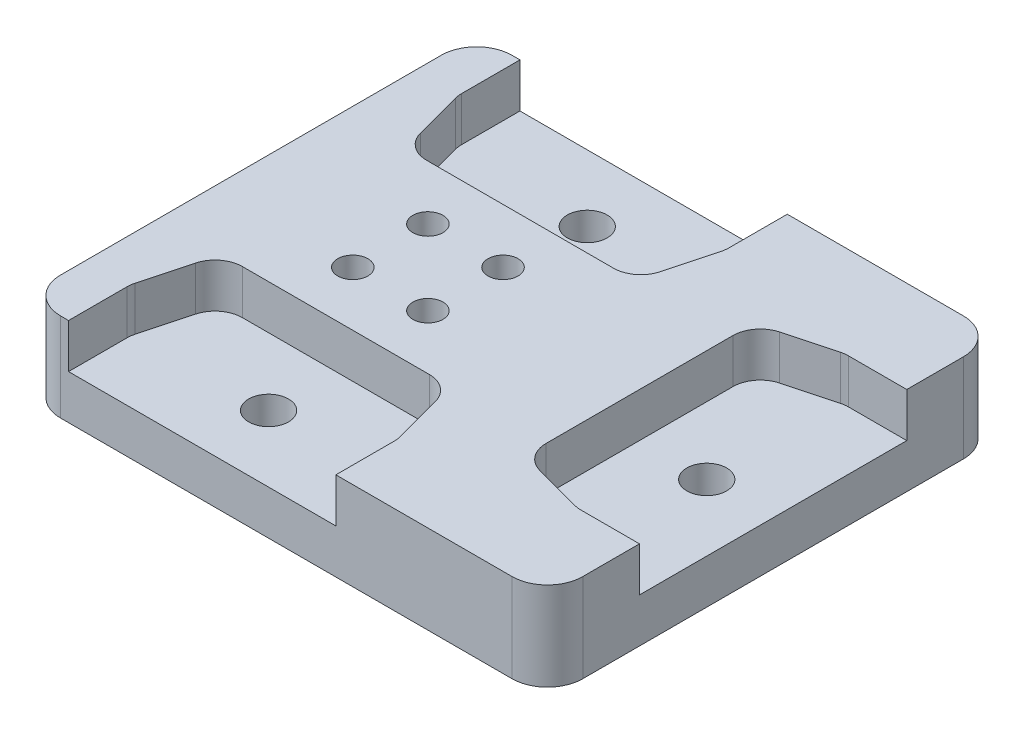
from build123d import *

# Parameters (mm, degrees)
SKETCH_1_W          = 59
SKETCH_1_H          = 51
EXTRUDE_1_DEPTH     = 10
CUT_EXTRUDE_1_DEPTH = 5
CUT_EXTRUDE_2_DEPTH = 5
HOLE_WIZARD_M31_D   = 3.4
FILLET_1_R          = 4
FILLET_2_R          = 4
HOLE_WIZARD_M41_D   = 4.5
CUT_EXTRUDE_4_DEPTH = 5


with BuildPart() as part:
    # Эскиз1 → Бобышка-Вытянуть1 (new body)
    with BuildSketch(Plane(origin=(0, 0, 0), x_dir=(1, 0, 0), z_dir=(0, 1, 0))):
        with Locations((29.5, 25.5)):
            Rectangle(SKETCH_1_W, SKETCH_1_H)
    extrude(amount=EXTRUDE_1_DEPTH)

    # Эскиз3 → Вырез-Вытянуть1 (cut)
    with BuildSketch(Plane(origin=(28.521351565, 10, -17.681729678), x_dir=(1, 0, 0), z_dir=(0, 1, 0))):
        with BuildLine():
            Line((-23.621351565, -11.07668717), (-23.621351565, -17.781729678))
            Line((-23.621351565, -17.781729678), (6.578648435, -17.781729678))
            Line((6.578648435, -17.781729678), (6.578648435, -11.07668717))
            ThreePointArc((6.578648435, -11.07668717), (6.552127505, -10.672055974), (6.473018496, -10.27434813))
            Line((6.473018496, -10.27434813), (5.027443993, -4.879390638))
            ThreePointArc((5.027443993, -4.879390638), (3.920234361, -3.222334323), (2.033073931, -2.581729678))
            Line((2.033073931, -2.581729678), (-19.075777062, -2.581729678))
            ThreePointArc((-19.075777062, -2.581729678), (-20.962937492, -3.222334323), (-22.070147123, -4.879390638))
            Line((-22.070147123, -4.879390638), (-23.515721627, -10.27434813))
            ThreePointArc((-23.515721627, -10.27434813), (-23.594830635, -10.672055974), (-23.621351565, -11.07668717))
        make_face()
    extrude(amount=-CUT_EXTRUDE_1_DEPTH, mode=Mode.SUBTRACT)

    # Эскиз4 → Вырез-Вытянуть2 (cut)
    with BuildSketch(Plane(origin=(0, 10, 0), x_dir=(1, 0, 0), z_dir=(0, 1, 0))):
        with BuildLine():
            Line((-1.551204442, 38.19766096), (-0.105629939, 43.592618453))
            ThreePointArc((-0.105629939, 43.592618453), (-0.02652093, 43.990326297), (0, 44.394957493))
            Line((0, 44.394957493), (0, 51))
            Line((0, 51), (-30.2, 51))
            Line((-30.2, 51), (-30.2, 44.394957493))
            ThreePointArc((-30.2, 44.394957493), (-30.17347907, 43.990326297), (-30.094370061, 43.592618453))
            Line((-30.094370061, 43.592618453), (-28.648795558, 38.19766096))
            ThreePointArc((-28.648795558, 38.19766096), (-27.541585927, 36.540604645), (-25.654425497, 35.9))
            Line((-25.654425497, 35.9), (-4.545574503, 35.9))
            ThreePointArc((-4.545574503, 35.9), (-2.658414073, 36.540604645), (-1.551204442, 38.19766096))
        make_face()
        with BuildLine():
            Line((46.19766096, 11.951204442), (51.592618453, 10.505629939))
            ThreePointArc((51.592618453, 10.505629939), (51.990326297, 10.42652093), (52.394957493, 10.4))
            Line((52.394957493, 10.4), (59, 10.4))
            Line((59, 10.4), (59, 40.6))
            Line((59, 40.6), (52.394957493, 40.6))
            ThreePointArc((52.394957493, 40.6), (51.990326297, 40.57347907), (51.592618453, 40.494370061))
            Line((51.592618453, 40.494370061), (46.19766096, 39.048795558))
            ThreePointArc((46.19766096, 39.048795558), (44.540604645, 37.941585927), (43.9, 36.054425497))
            Line((43.9, 36.054425497), (43.9, 14.945574503))
            ThreePointArc((43.9, 14.945574503), (44.540604645, 13.058414073), (46.19766096, 11.951204442))
        make_face()
    extrude(amount=-CUT_EXTRUDE_2_DEPTH, mode=Mode.SUBTRACT)

    # Отверстие с зазором M31 (through all)
    with Locations(Plane(origin=(0, 0, 0), x_dir=(-1, 0, 0), z_dir=(0, -1, 0))):
        with Locations((-24.242640687, 29.742640687), (-15.757359313, 29.742640687), (-15.757359313, 21.257359313), (-24.242640687, 21.257359313)):
            Hole(HOLE_WIZARD_M31_D / 2)

    # Скругление1
    fillet_1_edges = [part.edges().sort_by_distance(p)[0] for p in [
        (0, 5, -51),
        (0, 5, 0),
    ]]
    fillet(fillet_1_edges, radius=FILLET_1_R)

    # Скругление2
    fillet_2_edges = [part.edges().sort_by_distance(p)[0] for p in [
        (59, 5, -51),
        (59, 5, 0),
    ]]
    fillet(fillet_2_edges, radius=FILLET_2_R)

    # Отверстие с зазором M41 (through all)
    with Locations(Plane(origin=(0, 0, 0), x_dir=(-1, 0, 0), z_dir=(0, -1, 0))):
        with Locations((-51.5, 25.5), (-20, 43.5), (-20, 7.5)):
            Hole(HOLE_WIZARD_M41_D / 2)

    # Эскиз12 → Вырез-Вытянуть4 (cut)
    with BuildSketch(Plane(origin=(0, 10, 0), x_dir=(1, 0, 0), z_dir=(0, 1, 0))):
        with BuildLine():
            Line((4.9, 44.394957493), (4.9, 51))
            Line((4.9, 51), (35.1, 51))
            Line((35.1, 51), (35.1, 44.394957493))
            ThreePointArc((35.1, 44.394957493), (35.07347907, 43.990326297), (34.994370061, 43.592618453))
            Line((34.994370061, 43.592618453), (33.548795558, 38.19766096))
            ThreePointArc((33.548795558, 38.19766096), (32.441585927, 36.540604645), (30.554425497, 35.9))
            Line((30.554425497, 35.9), (9.445574503, 35.9))
            ThreePointArc((9.445574503, 35.9), (7.558414073, 36.540604645), (6.451204442, 38.19766096))
            Line((6.451204442, 38.19766096), (5.005629939, 43.592618453))
            ThreePointArc((5.005629939, 43.592618453), (4.92652093, 43.990326297), (4.9, 44.394957493))
        make_face()
    extrude(amount=-CUT_EXTRUDE_4_DEPTH, mode=Mode.SUBTRACT)


solid = part.part
